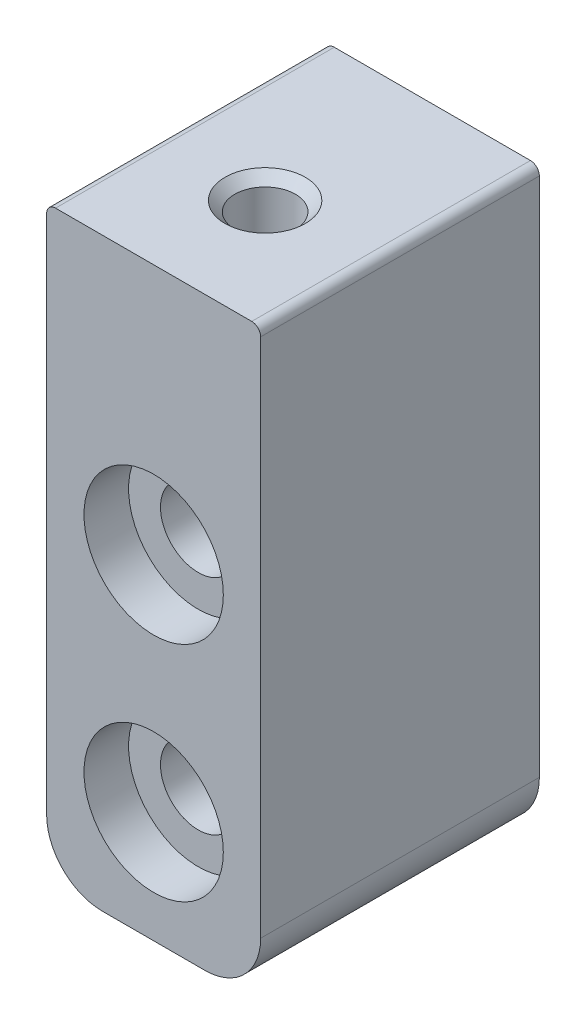
from build123d import *

# Parameters (mm, degrees)
SKETCH1_W                                      = 15.875
SKETCH1_H                                      = 33.3502
BOSS_EXTRUDE1_DEPTH                            = 6.096
CBORE_FOR_8_SOCKET_HEAD_CAP_SCREW1_D           = 4.3053
CBORE_FOR_8_SOCKET_HEAD_CAP_SCREW1_CBORE_D     = 7.9375
CBORE_FOR_8_SOCKET_HEAD_CAP_SCREW1_CBORE_DEPTH = 2.54
F_8_32_TAPPED_HOLE1_D                          = 3.4544
F_8_32_TAPPED_HOLE1_DEPTH                      = 15.24
F_8_32_TAPPED_HOLE1_CSINK_D                    = 4.572
F_8_32_TAPPED_HOLE1_CSINK_ANGLE                = 90
F_8_32_TAPPED_HOLE1_TIP                        = 1.037806461
FILLET1_R                                      = 3.175
FILLET2_R                                      = 0.508


with BuildPart() as part:
    # Sketch1 → Boss-Extrude1 (new, symmetric)
    with BuildSketch(Plane(origin=(0, 0, 0), x_dir=(0, 0, -1), z_dir=(1, 0, 0))):
        with Locations((-7.9375, -16.6751)):
            Rectangle(SKETCH1_W, SKETCH1_H)
    extrude(amount=BOSS_EXTRUDE1_DEPTH, both=True)

    # CBORE for #8 Socket Head Cap Screw1 (through all)
    with Locations(Plane.XY.offset(15.875)):
        with Locations((0, -14.3002), (0, -27.0002)):
            CounterBoreHole(CBORE_FOR_8_SOCKET_HEAD_CAP_SCREW1_D / 2, CBORE_FOR_8_SOCKET_HEAD_CAP_SCREW1_CBORE_D / 2, CBORE_FOR_8_SOCKET_HEAD_CAP_SCREW1_CBORE_DEPTH)

    # #8-32 Tapped Hole1
    with Locations(Plane(origin=(0, 0, 0), x_dir=(-1, 0, 0), z_dir=(0, 1, 0))):
        with Locations((0, 9.525)):
            CounterSinkHole(F_8_32_TAPPED_HOLE1_D / 2, F_8_32_TAPPED_HOLE1_CSINK_D / 2, depth=F_8_32_TAPPED_HOLE1_DEPTH, counter_sink_angle=F_8_32_TAPPED_HOLE1_CSINK_ANGLE)
            with Locations((0, 0, -(F_8_32_TAPPED_HOLE1_DEPTH + F_8_32_TAPPED_HOLE1_TIP / 2))):  # 118° drill point
                Cone(0, F_8_32_TAPPED_HOLE1_D / 2, F_8_32_TAPPED_HOLE1_TIP, mode=Mode.SUBTRACT)

    # Fillet1
    fillet1_edges = [part.edges().sort_by_distance(p)[0] for p in [
        (6.096, -33.3502, 7.9375),
        (-6.096, -33.3502, 7.9375),
    ]]
    fillet(fillet1_edges, radius=FILLET1_R)

    # Fillet2
    fillet2_edges = [part.edges().sort_by_distance(p)[0] for p in [
        (-6.096, 0, 7.9375),
        (6.096, 0, 7.9375),
    ]]
    fillet(fillet2_edges, radius=FILLET2_R)


solid = part.part
